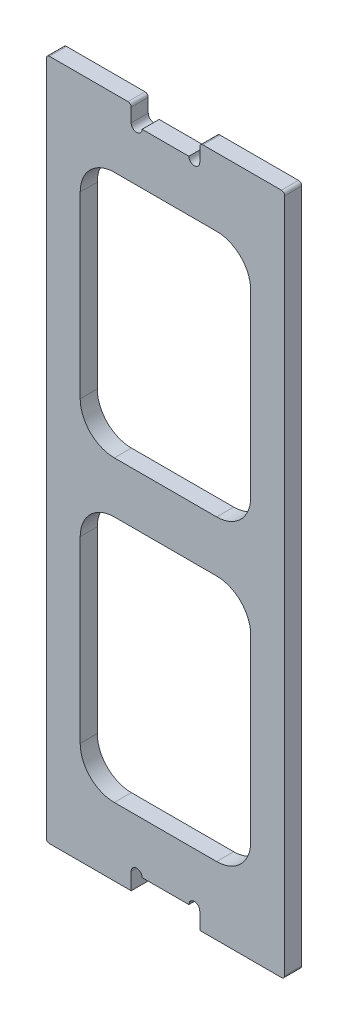
from build123d import *

# Parameters (mm, degrees)
SKETCH_1_W          = 25
SKETCH_1_H          = 5
SKETCH_1_W_2        = 70
SKETCH_1_H_2        = 190
EXTRUDE_1_DEPTH     = 5
SKETCH_2_R          = 1.55
CUT_EXTRUDE_1_DEPTH = 5
SKETCH_3_W          = 50
SKETCH_3_H          = 72.5
CUT_EXTRUDE_2_DEPTH = 5
FILLET_1_R          = 10
FILLET_2_R          = 1
MOVE_FACE_1_BY      = 0.05
MOVE_FACE_1_2_BY    = 0.05
MOVE_FACE_1_3_BY    = 0.05
MOVE_FACE_1_4_BY    = 0.05
MOVE_FACE_1_5_BY    = 0.05
MOVE_FACE_1_6_BY    = 0.05
MOVE_FACE_1_7_BY    = 0.05
MOVE_FACE_1_8_BY    = 0.05
MOVE_FACE_1_9_BY    = 0.05
MOVE_FACE_1_10_BY   = 0.05
MOVE_FACE_1_11_BY   = 0.05
MOVE_FACE_1_12_BY   = 0.05
MOVE_FACE_1_13_BY   = 0.05
MOVE_FACE_1_14_BY   = 0.05
MOVE_FACE_1_15_BY   = 0.05
MOVE_FACE_1_16_BY   = 0.05
MOVE_FACE_1_17_BY   = 0.05
MOVE_FACE_1_18_BY   = 0.05
MOVE_FACE_1_19_BY   = 0.05
MOVE_FACE_1_20_BY   = 0.05


with BuildPart() as part:
    # 草图1 → 凸台-拉伸1 (new body)
    with BuildSketch(Plane.XY):
        with Locations((57.5, 192.5)):
            Rectangle(SKETCH_1_W, SKETCH_1_H)
        with Locations((35, 95)):
            Rectangle(SKETCH_1_W_2, SKETCH_1_H_2)
        with Locations((12.5, 192.5)):
            Rectangle(SKETCH_1_W, SKETCH_1_H)
        with Locations((57.5, -2.5)):
            Rectangle(SKETCH_1_W, SKETCH_1_H)
        with Locations((12.5, -2.5)):
            Rectangle(SKETCH_1_W, SKETCH_1_H)
    extrude(amount=EXTRUDE_1_DEPTH)

    # 草图2 → 切除-拉伸1 (cut)
    with BuildSketch(Plane.XY.offset(5)):
        with Locations((43.45, 0)):
            Circle(SKETCH_2_R)
        with Locations((26.55, 0)):
            Circle(SKETCH_2_R)
        with Locations((43.45, 190)):
            Circle(SKETCH_2_R)
        with Locations((26.55, 190)):
            Circle(SKETCH_2_R)
    extrude(amount=-CUT_EXTRUDE_1_DEPTH, mode=Mode.SUBTRACT)

    # 草图3 → 切除-拉伸2 (cut)
    with BuildSketch(Plane.XY.offset(5)):
        with Locations((35, 51.25)):
            Rectangle(SKETCH_3_W, SKETCH_3_H)
        with Locations((35, 138.75)):
            Rectangle(SKETCH_3_W, SKETCH_3_H)
    extrude(amount=-CUT_EXTRUDE_2_DEPTH, mode=Mode.SUBTRACT)

    # 圆角1
    fillet_1_edges = [part.edges().sort_by_distance(p)[0] for p in [
        (10, 175, 2.5),
        (60, 175, 2.5),
        (60, 102.5, 2.5),
        (10, 15, 2.5),
        (10, 87.5, 2.5),
        (60, 87.5, 2.5),
        (60, 15, 2.5),
        (10, 102.5, 2.5),
    ]]
    fillet(fillet_1_edges, radius=FILLET_1_R)

    # 圆角2
    fillet_2_edges = [part.edges().sort_by_distance(p)[0] for p in [
        (45, 195, 2.5),
        (70, 195, 2.5),
        (70, -5, 2.5),
        (0, -5, 2.5),
        (0, 195, 2.5),
        (25, 195, 2.5),
    ]]
    fillet(fillet_2_edges, radius=FILLET_2_R)

    # Move Face 1: a curved face moved inward by 0.05
    add(Solid.thicken(part.faces().sort_by_distance((69.707106781, -4.707106781, 2.5))[0], -MOVE_FACE_1_BY), mode=Mode.SUBTRACT)

    # Move Face 1 2: a face moved inward by 0.05
    extrude(part.faces().sort_by_distance((57, -5, 2.5))[0], amount=MOVE_FACE_1_2_BY, dir=(0, 1, 0), mode=Mode.SUBTRACT)

    # Move Face 1 3: a face moved inward by 0.05
    extrude(part.faces().sort_by_distance((45, -2.5, 2.5))[0], amount=MOVE_FACE_1_3_BY, dir=(1, 0, 0), mode=Mode.SUBTRACT)

    # Move Face 1 4: a curved face moved inward by 0.05
    add(Solid.thicken(part.faces().sort_by_distance((43.45, 1.55, 2.5))[0], -MOVE_FACE_1_4_BY), mode=Mode.SUBTRACT)

    # Move Face 1 5: a face moved inward by 0.05
    extrude(part.faces().sort_by_distance((25, -2.5, 2.5))[0], amount=MOVE_FACE_1_5_BY, dir=(-1, 0, 0), mode=Mode.SUBTRACT)

    # Move Face 1 6: a curved face moved inward by 0.05
    add(Solid.thicken(part.faces().sort_by_distance((26.55, 1.55, 2.5))[0], -MOVE_FACE_1_6_BY), mode=Mode.SUBTRACT)

    # Move Face 1 7: a face moved inward by 0.05
    extrude(part.faces().sort_by_distance((13, -5, 2.5))[0], amount=MOVE_FACE_1_7_BY, dir=(0, 1, 0), mode=Mode.SUBTRACT)

    # Move Face 1 8: a curved face moved inward by 0.05
    add(Solid.thicken(part.faces().sort_by_distance((0.292893219, -4.707106781, 2.5))[0], -MOVE_FACE_1_8_BY), mode=Mode.SUBTRACT)

    # Move Face 1 9: a face moved inward by 0.05
    extrude(part.faces().sort_by_distance((0, 95, 2.5))[0], amount=MOVE_FACE_1_9_BY, dir=(1, 0, 0), mode=Mode.SUBTRACT)

    # Move Face 1 10: a curved face moved inward by 0.05
    add(Solid.thicken(part.faces().sort_by_distance((0.292893219, 194.707106781, 2.5))[0], -MOVE_FACE_1_10_BY), mode=Mode.SUBTRACT)

    # Move Face 1 11: a face moved inward by 0.05
    extrude(part.faces().sort_by_distance((12.5, 195, 2.5))[0], amount=MOVE_FACE_1_11_BY, dir=(0, -1, 0), mode=Mode.SUBTRACT)

    # Move Face 1 12: a curved face moved inward by 0.05
    add(Solid.thicken(part.faces().sort_by_distance((24.707106781, 194.707106781, 2.5))[0], -MOVE_FACE_1_12_BY), mode=Mode.SUBTRACT)

    # Move Face 1 13: a face moved inward by 0.05
    extrude(part.faces().sort_by_distance((25, 192, 2.5))[0], amount=MOVE_FACE_1_13_BY, dir=(-1, 0, 0), mode=Mode.SUBTRACT)

    # Move Face 1 14: a curved face moved inward by 0.05
    add(Solid.thicken(part.faces().sort_by_distance((26.55, 188.45, 2.5))[0], -MOVE_FACE_1_14_BY), mode=Mode.SUBTRACT)

    # Move Face 1 15: a curved face moved inward by 0.05
    add(Solid.thicken(part.faces().sort_by_distance((43.45, 188.45, 2.5))[0], -MOVE_FACE_1_15_BY), mode=Mode.SUBTRACT)

    # Move Face 1 16: a face moved inward by 0.05
    extrude(part.faces().sort_by_distance((45, 192, 2.5))[0], amount=MOVE_FACE_1_16_BY, dir=(1, 0, 0), mode=Mode.SUBTRACT)

    # Move Face 1 17: a curved face moved inward by 0.05
    add(Solid.thicken(part.faces().sort_by_distance((45.292893219, 194.707106781, 2.5))[0], -MOVE_FACE_1_17_BY), mode=Mode.SUBTRACT)

    # Move Face 1 18: a face moved inward by 0.05
    extrude(part.faces().sort_by_distance((57.5, 195, 2.5))[0], amount=MOVE_FACE_1_18_BY, dir=(0, -1, 0), mode=Mode.SUBTRACT)

    # Move Face 1 19: a curved face moved inward by 0.05
    add(Solid.thicken(part.faces().sort_by_distance((69.707106781, 194.707106781, 2.5))[0], -MOVE_FACE_1_19_BY), mode=Mode.SUBTRACT)

    # Move Face 1 20: a face moved inward by 0.05
    extrude(part.faces().sort_by_distance((70, 95, 2.5))[0], amount=MOVE_FACE_1_20_BY, dir=(-1, 0, 0), mode=Mode.SUBTRACT)


solid = part.part
